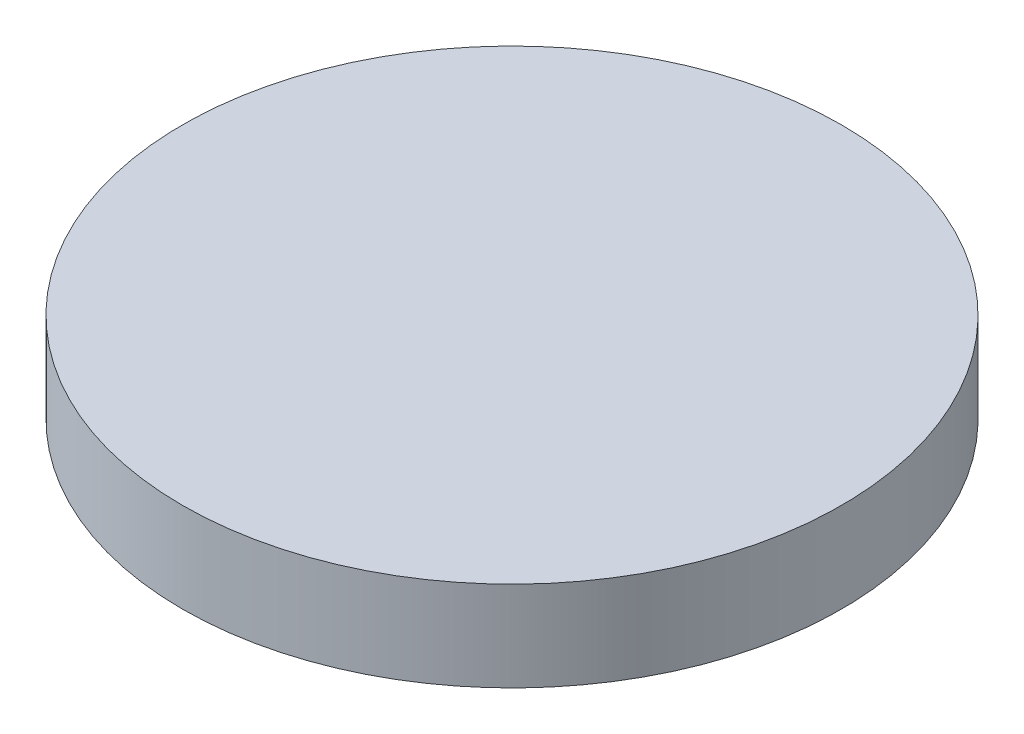
from build123d import *

# Parameters (mm, degrees)
SKETCH1_R           = 69.85
BOSS_EXTRUDE1_DEPTH = 19.05


with BuildPart() as part:
    # Sketch1 → Boss-Extrude1 (new body)
    with BuildSketch(Plane(origin=(0, 0, 0), x_dir=(1, 0, 0), z_dir=(0, 1, 0))):
        with Locations(Location((0, 0, 0), (0, 0, 90))):
            Circle(SKETCH1_R)
    extrude(amount=BOSS_EXTRUDE1_DEPTH)


solid = part.part
